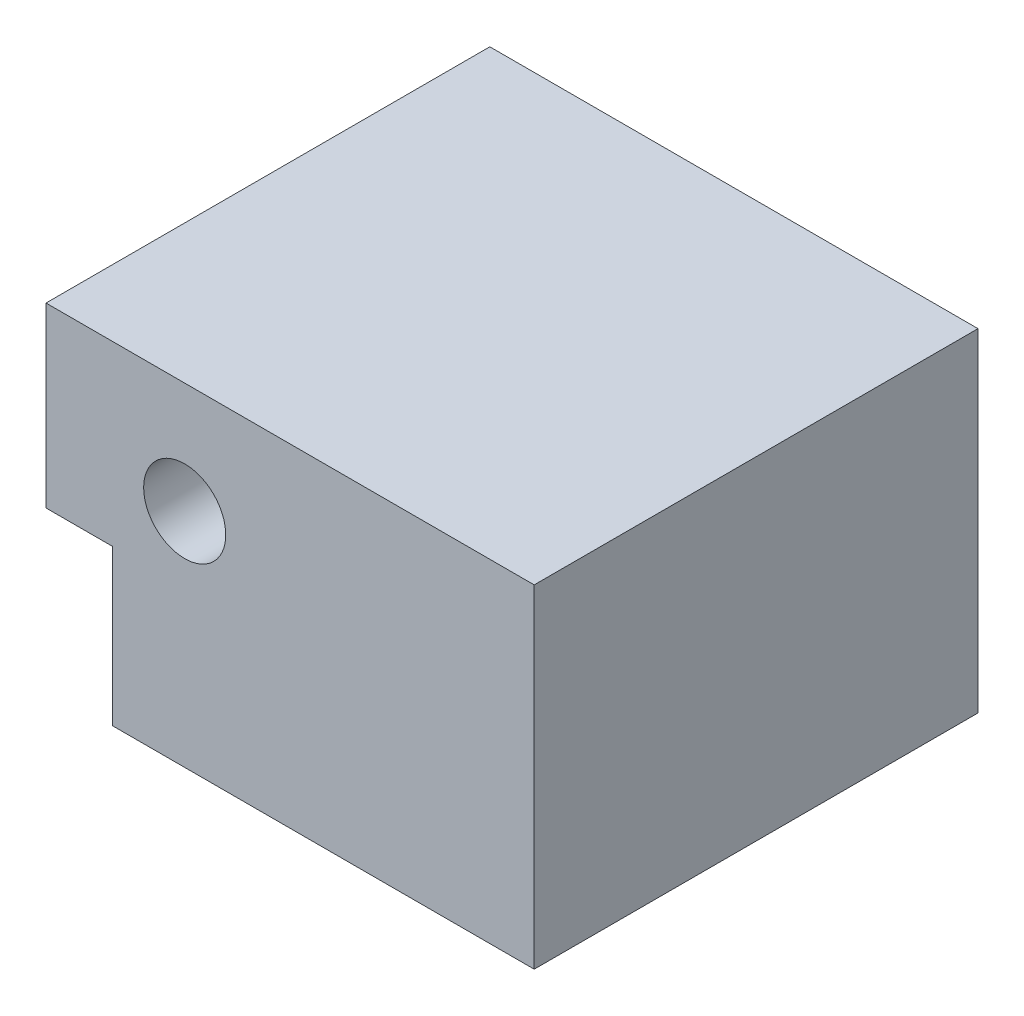
from build123d import *

# Parameters (mm, degrees)
SKETCH2_W                      = 19
SKETCH2_H                      = 20
BOSS_EXTRUDE1_DEPTH            = 7.5
F_3_7_3_7_DIAMETER_HOLE2_D     = 3.7
F_3_7_3_7_DIAMETER_HOLE2_DEPTH = 11.6
F_3_7_3_7_DIAMETER_HOLE2_TIP   = 1.111592145
SKETCH10_W                     = 20
SKETCH10_H                     = 8
BOSS_EXTRUDE2_DEPTH            = 3
F_3_7_3_7_DIAMETER_HOLE1_D     = 3.7


with BuildPart() as part:
    # Sketch2 → Boss-Extrude1 (new, symmetric)
    with BuildSketch(Plane(origin=(0, 0, 0), x_dir=(1, 0, 0), z_dir=(0, 1, 0))):
        Rectangle(SKETCH2_W, SKETCH2_H)
    extrude(amount=BOSS_EXTRUDE1_DEPTH, both=True)

    # Ø3.7 (3.7) Diameter Hole2
    with Locations(Plane.ZY.offset(9.5)):
        with Locations((-5, -3.5), (5, -3.5)):
            Hole(F_3_7_3_7_DIAMETER_HOLE2_D / 2, depth=F_3_7_3_7_DIAMETER_HOLE2_DEPTH)
            with Locations((0, 0, -(F_3_7_3_7_DIAMETER_HOLE2_DEPTH + F_3_7_3_7_DIAMETER_HOLE2_TIP / 2))):  # 118° drill point
                Cone(0, F_3_7_3_7_DIAMETER_HOLE2_D / 2, F_3_7_3_7_DIAMETER_HOLE2_TIP, mode=Mode.SUBTRACT)

    # Sketch10 → Boss-Extrude2 (add)
    with BuildSketch(Plane.ZY.offset(9.5)):
        with Locations((0, 3.5)):
            Rectangle(SKETCH10_W, SKETCH10_H)
    extrude(amount=BOSS_EXTRUDE2_DEPTH)

    # Ø3.7 (3.7) Diameter Hole1 (through all)
    with Locations(Plane(origin=(0, 0, -10), x_dir=(-1, 0, 0), z_dir=(0, 0, -1))):
        with Locations((6.25, 2.5)):
            Hole(F_3_7_3_7_DIAMETER_HOLE1_D / 2)


solid = part.part
